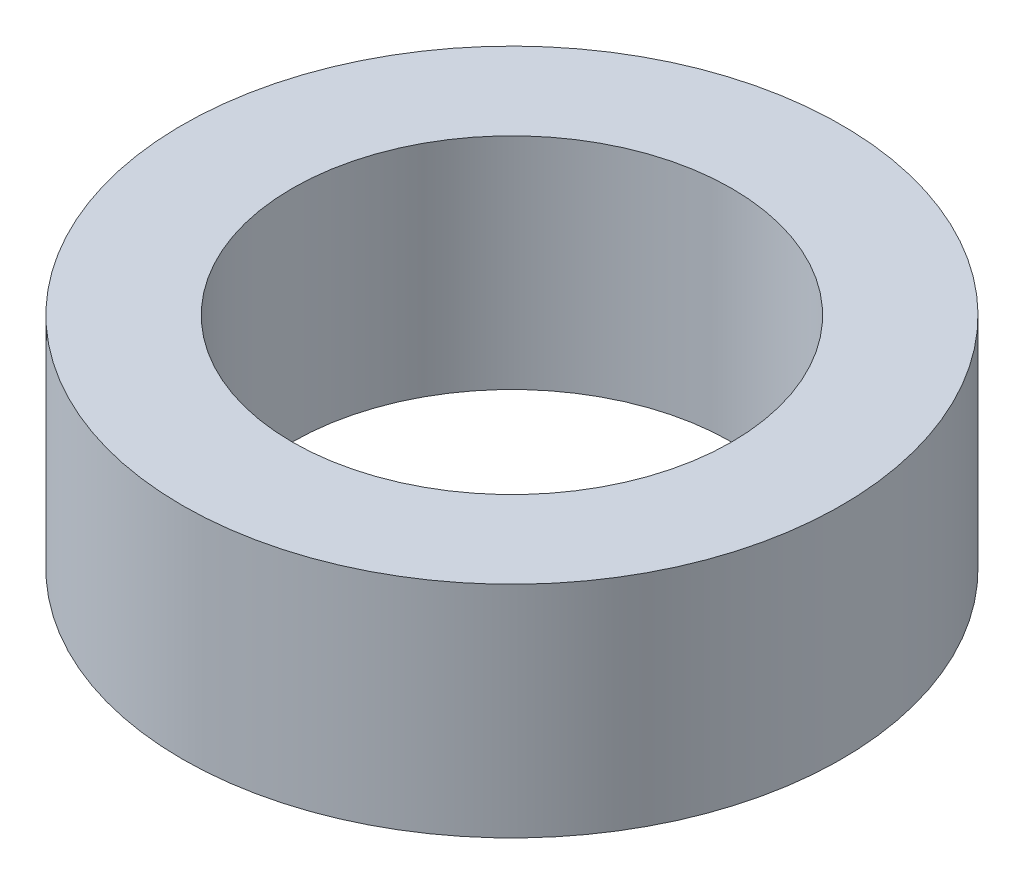
from build123d import *

# Parameters (mm, degrees)
SKETCH1_R           = 4.5
SKETCH1_R_2         = 3
BOSS_EXTRUDE1_DEPTH = 3


with BuildPart() as part:
    # Sketch1 → Boss-Extrude1 (new body)
    with BuildSketch(Plane(origin=(0, 0, 0), x_dir=(1, 0, 0), z_dir=(0, 1, 0))):
        with Locations(Location((0, 0, 0), (0, 0, 270))):
            Circle(SKETCH1_R)
        with Locations(Location((0, 0, 0), (0, 0, 270))):
            Circle(SKETCH1_R_2, mode=Mode.SUBTRACT)
    extrude(amount=BOSS_EXTRUDE1_DEPTH)


solid = part.part
